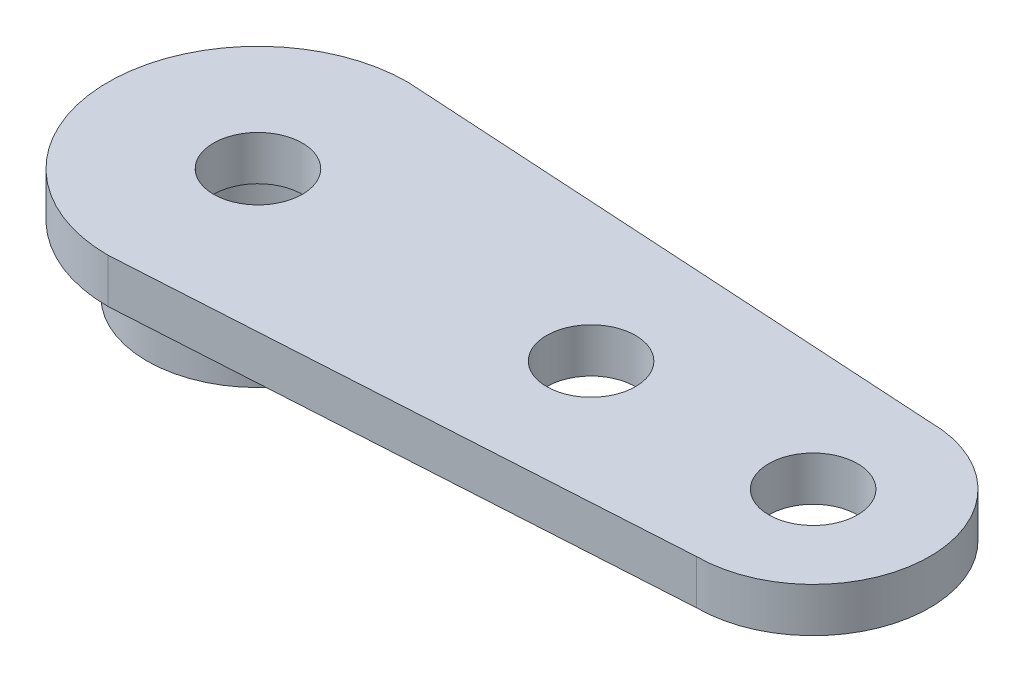
from build123d import *

# Parameters (mm, degrees)
SKETCH_2_R      = 1
EXTRUDE_1_DEPTH = 1
SKETCH_3_R      = 2.5
SKETCH_3_R_2    = 1.75
EXTRUDE_2_DEPTH = 1.5


with BuildPart() as part:
    # 草图2 → 凸台-拉伸1 (new body)
    with BuildSketch(Plane(origin=(0, 0, 0), x_dir=(1, 0, 0), z_dir=(0, 1, 0))):
        with BuildLine():
            Line((0.40354723, 3.350787166), (0, 3.375))
            ThreePointArc((0, 3.375), (-3.375, 0), (0, -3.375))
            Line((0, -3.375), (0.40354723, -3.350787166))
            Line((0.40354723, -3.350787166), (12.5, -2.625))
            ThreePointArc((12.5, -2.625), (15.125, 0), (12.5, 2.625))
            Line((12.5, 2.625), (0.40354723, 3.350787166))
        make_face()
        with Locations(Location((0, 0, 0), (0, 0, 270))):
            Circle(SKETCH_2_R, mode=Mode.SUBTRACT)
        with Locations(Location((7.5, 0, 0), (0, 0, 270))):
            Circle(SKETCH_2_R, mode=Mode.SUBTRACT)
        with Locations(Location((12.5, 0, 0), (0, 0, 270))):
            Circle(SKETCH_2_R, mode=Mode.SUBTRACT)
    extrude(amount=EXTRUDE_1_DEPTH)

    # 草图3 → 凸台-拉伸2 (add)
    with BuildSketch(Plane(origin=(0, 0, 0), x_dir=(1, 0, 0), z_dir=(0, 1, 0))):
        with Locations(Location((0, 0, 0), (0, 0, 270))):
            Circle(SKETCH_3_R)
        with Locations(Location((0, 0, 0), (0, 0, 270))):
            Circle(SKETCH_3_R_2, mode=Mode.SUBTRACT)
    extrude(amount=-EXTRUDE_2_DEPTH)


solid = part.part
